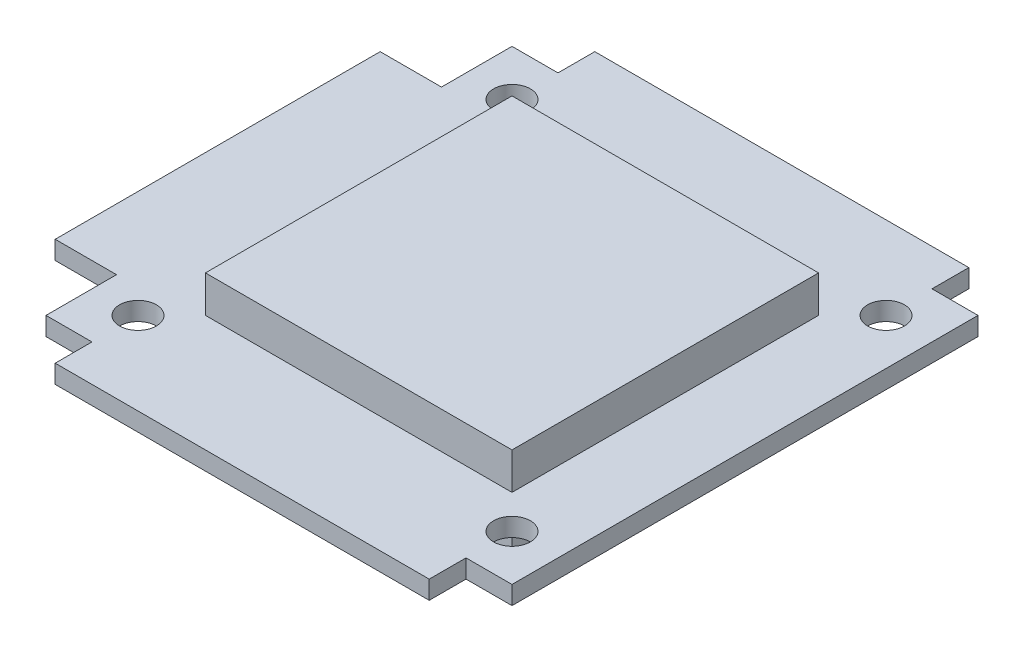
from build123d import *

# Parameters (mm, degrees)
SKETCH_1_W           = 38
SKETCH_1_H           = 38
SKETCH_1_R           = 1.5
EXTRUDE_1_DEPTH      = 1.5
SKETCH_2_W           = 5
SKETCH_2_H           = 26.5
SKETCH_2_W_2         = 30.5
SKETCH_2_H_2         = 3
EXTRUDE_2_DEPTH      = 1.5
EXTRUDE_3_DEPTH      = 3
EXTRUDE_3_DEPTH_BACK = 4.5
SKETCH_3_W           = 25
SKETCH_3_H           = 25


with BuildPart() as part:
    # 草图1 → 凸台-拉伸1 (new body)
    with BuildSketch(Plane(origin=(0, 0, 0), x_dir=(1, 0, 0), z_dir=(0, 1, 0))):
        Rectangle(SKETCH_1_W, SKETCH_1_H)
        with Locations(Location((-15.25, 15.25, 0), (0, 0, 270))):
            Circle(SKETCH_1_R, mode=Mode.SUBTRACT)
        with Locations(Location((15.25, 15.25, 0), (0, 0, 270))):
            Circle(SKETCH_1_R, mode=Mode.SUBTRACT)
        with Locations(Location((15.25, -15.25, 0), (0, 0, 270))):
            Circle(SKETCH_1_R, mode=Mode.SUBTRACT)
        with Locations(Location((-15.25, -15.25, 0), (0, 0, 270))):
            Circle(SKETCH_1_R, mode=Mode.SUBTRACT)
    extrude(amount=EXTRUDE_1_DEPTH)

    # 草图2 → 凸台-拉伸2 (add)
    with BuildSketch(Plane.XZ):
        with Locations((-21.5, 0)):
            Rectangle(SKETCH_2_W, SKETCH_2_H)
        with Locations((0, -20.5)):
            Rectangle(SKETCH_2_W_2, SKETCH_2_H_2)
        with Locations((0, 20.5)):
            Rectangle(SKETCH_2_W_2, SKETCH_2_H_2)
    extrude(amount=-EXTRUDE_2_DEPTH)

    # 草图3 → 凸台-拉伸3 (add, two sides: drawn at the far end of the back side and taken through both)
    with BuildSketch(Plane(origin=(0, 1.5, 0), x_dir=(1, 0, 0), z_dir=(0, 1, 0)).offset(-EXTRUDE_3_DEPTH_BACK)):
        Rectangle(SKETCH_3_W, SKETCH_3_H)
    extrude(amount=EXTRUDE_3_DEPTH + EXTRUDE_3_DEPTH_BACK)


solid = part.part
